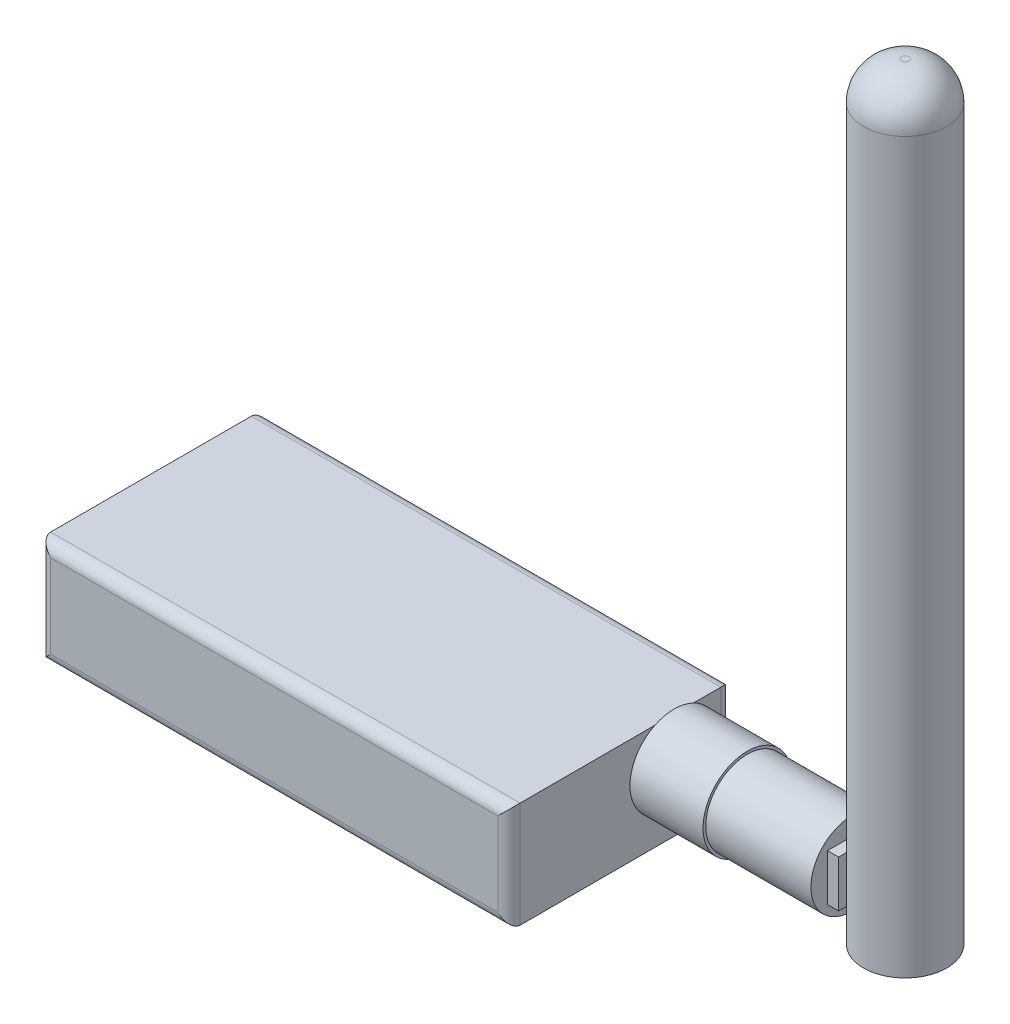
from build123d import *

# Parameters (mm, degrees)
SKETCH1_W           = 53.52
SKETCH1_H           = 25.42
BOSS_EXTRUDE2_DEPTH = 12.06
SKETCH2_R           = 5.05
BOSS_EXTRUDE3_DEPTH = 8.33
FILLET2_R           = 1.27
FILLET3_R           = 1.27
SKETCH3_R           = 4.745
BOSS_EXTRUDE4_DEPTH = 12
SKETCH10_R          = 4.745000035
BOSS_EXTRUDE8_DEPTH = 87.4
FILLET4_R           = 4.318
SKETCH4_W           = 5.72
SKETCH4_H           = 5.32
BOSS_EXTRUDE9_DEPTH = 1.27


with BuildPart() as part:
    # Sketch1 → Boss-Extrude2 (new body)
    with BuildSketch(Plane(origin=(0, 0, 0), x_dir=(1, 0, 0), z_dir=(0, 1, 0))):
        with Locations((0.655882353, 2.019117647)):
            Rectangle(SKETCH1_W, SKETCH1_H)
    extrude(amount=BOSS_EXTRUDE2_DEPTH)

    # Sketch2 → Boss-Extrude3 (add)
    with BuildSketch(Plane(origin=(27.415882353, 0, 0), x_dir=(0, 0, -1), z_dir=(1, 0, 0))):
        with Locations(Location((8.151317647, 7.5138, 0), (0, 0, 115.810680581))):
            Circle(SKETCH2_R)
    extrude(amount=BOSS_EXTRUDE3_DEPTH)

    # Fillet2
    fillet2_edges = [part.edges().sort_by_distance(p)[0] for p in [
        (0.655882353, 0, 10.690882353),
        (0.655882353, 12.06, 10.690882353),
        (27.415882353, 6.03, 10.690882353),
        (-26.104117647, 6.03, 10.690882353),
    ]]
    fillet(fillet2_edges, radius=FILLET2_R)

    # Fillet3
    fillet3_edges = [part.edges().sort_by_distance(p)[0] for p in [
        (0.655882353, 12.06, -14.729117647),
        (0.655882353, 0, -14.729117647),
        (-26.104117647, 6.03, -14.729117647),
        (27.415882353, 6.03, -14.729117647),
    ]]
    fillet(fillet3_edges, radius=FILLET3_R)

    # Sketch3 → Boss-Extrude4 (add)
    with BuildSketch(Plane(origin=(35.745882353, 0, 0), x_dir=(0, 0, -1), z_dir=(1, 0, 0))):
        with Locations((8.151317647, 7.5138)):
            Circle(SKETCH3_R)
    extrude(amount=BOSS_EXTRUDE4_DEPTH)

    # Sketch4 → Boss-Extrude9 (add)
    with BuildSketch(Plane(origin=(47.745882353, 0, 0), x_dir=(0, 0, -1), z_dir=(1, 0, 0))):
        with Locations((8.151317647, 7.5138)):
            Rectangle(SKETCH4_W, SKETCH4_H)
    extrude(amount=BOSS_EXTRUDE9_DEPTH)


with BuildPart() as body_2:
    # Sketch10 → Boss-Extrude8 (new body)
    with BuildSketch(Plane(origin=(0, 2.54, 0), x_dir=(1, 0, 0), z_dir=(0, 1, 0))):
        with Locations(Location((53.760882261, 8.128, 0), (0, 0, 270))):
            Circle(SKETCH10_R)
    extrude(amount=BOSS_EXTRUDE8_DEPTH)

    # Fillet4
    fillet4_edges = [body_2.edges().sort_by_distance(p)[0] for p in [
        (53.760882261, 89.94, -12.873000035),
    ]]
    fillet(fillet4_edges, radius=FILLET4_R)


solid = Compound([part.part, body_2.part])
